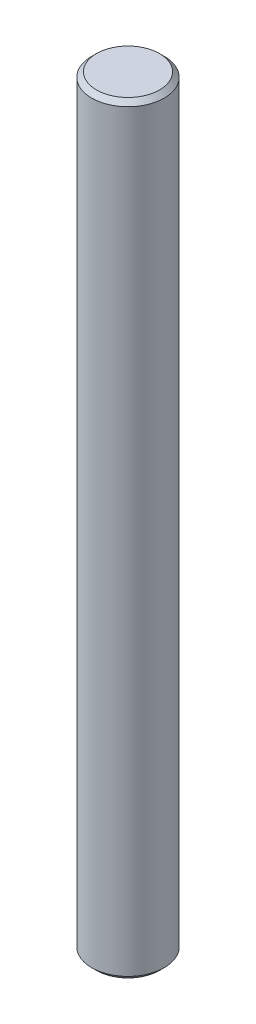
from build123d import *

# Parameters (mm, degrees)
SKETCH1_R           = 3.85
BOSS_EXTRUDE1_DEPTH = 40.5
CHAMFER1_SIZE       = 0.5


with BuildPart() as part:
    # Sketch1 → Boss-Extrude1 (new, symmetric)
    with BuildSketch(Plane(origin=(0, 0, 0), x_dir=(1, 0, 0), z_dir=(0, 1, 0))):
        with Locations(Location((0, 0, 0), (0, 0, 270))):
            Circle(SKETCH1_R)
    extrude(amount=BOSS_EXTRUDE1_DEPTH, both=True)

    # Chamfer1
    chamfer1_edges = [part.edges().sort_by_distance(p)[0] for p in [
        (0, -40.5, -3.85),
        (0, 40.5, -3.85),
    ]]
    chamfer(chamfer1_edges, length=CHAMFER1_SIZE)


solid = part.part
